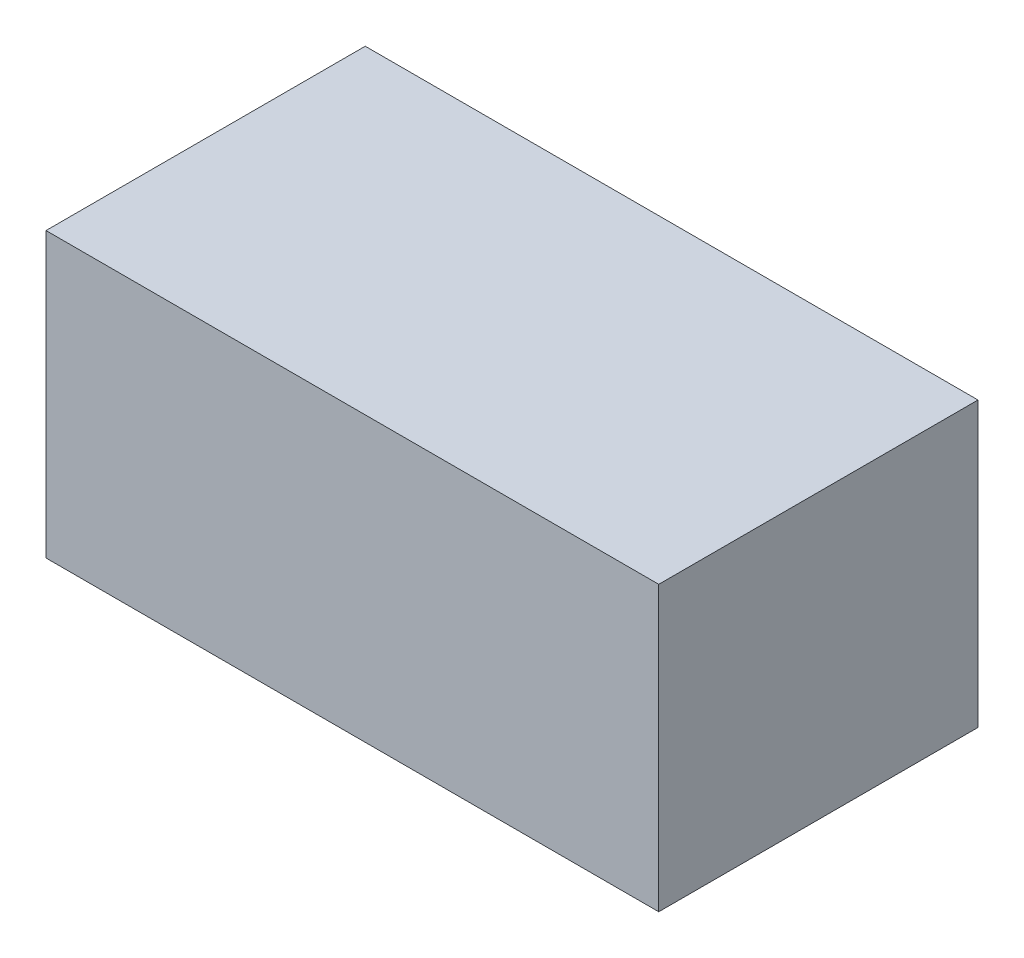
from build123d import *

# Parameters (mm, degrees)
SKETCH1_W           = 59.817
SKETCH1_H           = 31.1658
BOSS_EXTRUDE1_DEPTH = 27.686


with BuildPart() as part:
    # Sketch1 → Boss-Extrude1 (new body)
    with BuildSketch(Plane(origin=(0, 0, 0), x_dir=(1, 0, 0), z_dir=(0, 1, 0))):
        with Locations((29.9085, 0)):
            Rectangle(SKETCH1_W, SKETCH1_H)
    extrude(amount=BOSS_EXTRUDE1_DEPTH)


solid = part.part
